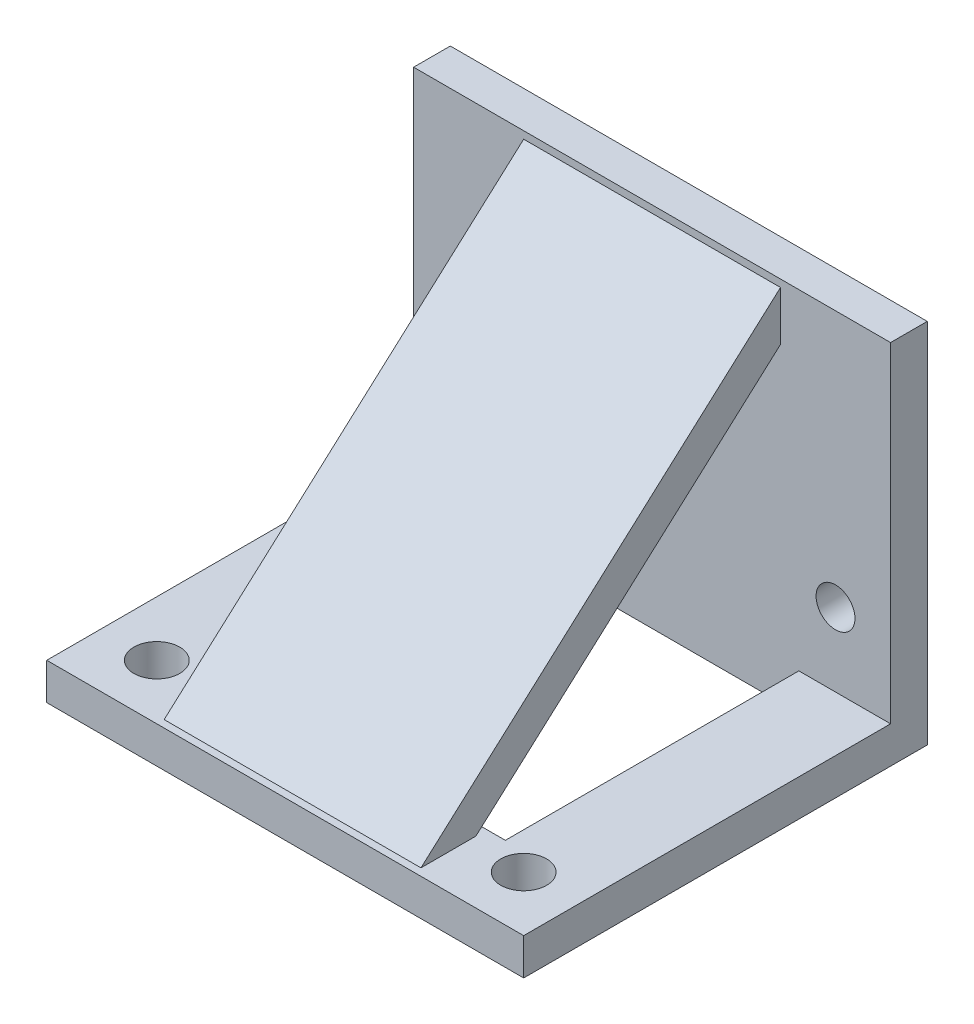
from build123d import *

# Parameters (mm, degrees)
SKETCH1_W           = 65
SKETCH1_H           = 50
BOSS_EXTRUDE1_DEPTH = 5
SKETCH7_W           = 65
SKETCH7_H           = 50
BOSS_EXTRUDE5_DEPTH = 50
CUT_EXTRUDE4_DEPTH  = 99.742088291
SKETCH9_R           = 2.65
CUT_EXTRUDE5_DEPTH  = 78.821912081
SKETCH10_R          = 3.125
CUT_EXTRUDE6_DEPTH  = 79.14249804
CUT_EXTRUDE14_DEPTH = 15
CUT_EXTRUDE15_START = -65
CUT_EXTRUDE15_DEPTH = 15
CUT_EXTRUDE16_DEPTH = 99.742088291
CUT_EXTRUDE17_REACH = 83.125
SKETCH26_W          = 40
SKETCH26_H          = 40


with BuildPart() as part:
    # Sketch1 → Boss-Extrude1 (new body)
    with BuildSketch(Plane.XY):
        with Locations((0, 25)):
            Rectangle(SKETCH1_W, SKETCH1_H)
    extrude(amount=BOSS_EXTRUDE1_DEPTH)

    # Sketch7 → Boss-Extrude5 (add)
    with BuildSketch(Plane.XY.offset(5)):
        with Locations((0, 25)):
            Rectangle(SKETCH7_W, SKETCH7_H)
    extrude(amount=BOSS_EXTRUDE5_DEPTH)

    # Sketch8 → Cut-Extrude4 (cut, through all)
    with BuildSketch(Plane.ZY.offset(32.5)):
        Polygon((55, 50), (5, 50), (5, 49), (54, 5), (55, 5), align=None)
    extrude(amount=-CUT_EXTRUDE4_DEPTH, mode=Mode.SUBTRACT)

    # Sketch9 → Cut-Extrude5 (cut, through all)
    with BuildSketch(Plane.XY.offset(5)):
        with Locations((-25, 15)):
            Circle(SKETCH9_R)
        with Locations(Location((25, 15, 0), (0, 0, 180))):
            Circle(SKETCH9_R)
    extrude(amount=-CUT_EXTRUDE5_DEPTH, mode=Mode.SUBTRACT)

    # Sketch10 → Cut-Extrude6 (cut, through all)
    with BuildSketch(Plane(origin=(0, 5, 0), x_dir=(1, 0, 0), z_dir=(0, 1, 0))):
        with Locations(Location((-25, -47.5, 0), (0, 0, 180))):
            Circle(SKETCH10_R)
        with Locations((25, -47.5)):
            Circle(SKETCH10_R)
    extrude(amount=-CUT_EXTRUDE6_DEPTH, mode=Mode.SUBTRACT)

    # Sketch24 → Cut-Extrude14 (cut)
    with BuildSketch(Plane(origin=(32.5, 0, 0), x_dir=(0, 0, -1), z_dir=(1, 0, 0))):
        Polygon((-5, 49), (-54, 5), (-5, 5), align=None)
    extrude(amount=-CUT_EXTRUDE14_DEPTH, mode=Mode.SUBTRACT)

    # Sketch24<2> → Cut-Extrude15 (cut)
    with BuildSketch(Plane(origin=(32.5, 0, 0), x_dir=(0, 0, -1), z_dir=(1, 0, 0)).offset(CUT_EXTRUDE15_START)):
        Polygon((-5, 49), (-54, 5), (-5, 5), align=None)
    extrude(amount=CUT_EXTRUDE15_DEPTH, mode=Mode.SUBTRACT)

    # Sketch25 → Cut-Extrude16 (cut, through all)
    with BuildSketch(Plane(origin=(32.5, 0, 0), x_dir=(0, 0, -1), z_dir=(1, 0, 0))):
        Polygon((-5, 5), (-5, 42.280009867), (-46.516374625, 5), align=None)
    extrude(amount=-CUT_EXTRUDE16_DEPTH, mode=Mode.SUBTRACT)

    # Sketch26 → Cut-Extrude17 (cut, up to next)
    with BuildSketch(Plane.XZ, mode=Mode.PRIVATE) as cut_extrude17_sk1:
        with Locations((0, 25)):
            Rectangle(SKETCH26_W, SKETCH26_H)
    cut_extrude17_tool1 = extrude(cut_extrude17_sk1.sketch, amount=-CUT_EXTRUDE17_REACH, mode=Mode.PRIVATE) & part.part
    add(cut_extrude17_tool1.solids().sort_by_distance((0, 0, 25))[0], mode=Mode.SUBTRACT)


solid = part.part
